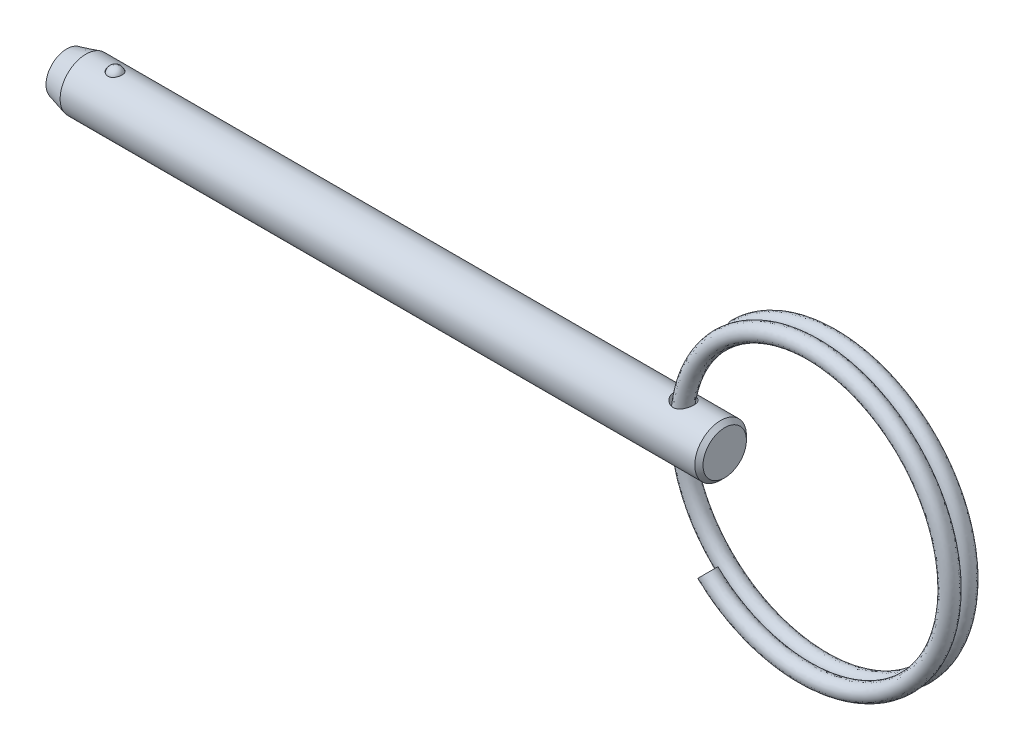
from build123d import *

# Parameters (mm, degrees)
SKETCH4_W          = 0.9525
SKETCH4_H          = 4.7625
SWEEP1_PITCH       = 1.5494
SWEEP1_HEIGHT      = 1.355725
SWEEP1_RADIUS      = 13.462
SKETCH6_R          = 0.762
SWEEP2_PITCH       = 1.5494
SWEEP2_HEIGHT      = 1.355725
SWEEP2_RADIUS      = 13.462
SWEEP2_START_ANGLE = -180
SKETCH6_2_R        = 0.762


with BuildPart() as part:
    # Sketch1 → Revolve1 (revolve)
    with BuildSketch(Plane.XY, mode=Mode.PRIVATE) as revolve1_sk:
        Polygon((30.3149, 2.00025), (29.9339, 2.38125), (-28.537510803, 2.38125), (-30.3149, 1.905), (-30.3149, 0), (30.3149, 0), align=None)
    revolve(revolve1_sk.sketch.rotate(Axis((30.3149, 0, 0), (1, 0, 0)), 180), axis=Axis((30.3149, 0, 0), (1, 0, 0)))

    # Sketch2 → Cut-Revolve1 (revolve, cut)
    with BuildSketch(Plane.XY):
        with BuildLine():
            Line((-25.164844331, 2.143125), (-26.530094331, 2.143125))
            ThreePointArc((-26.530094331, 2.143125), (-25.847469331, 2.82575), (-25.164844331, 2.143125))
        make_face()
    revolve(axis=Axis((-25.164844331, 2.143125, 0), (1, 0, 0)), mode=Mode.SUBTRACT)

    # Sketch4 → Cut-Revolve2 (revolve, cut)
    with BuildSketch(Plane.XY, mode=Mode.PRIVATE) as cut_revolve2_sk:
        with Locations((26.99385, 0)):
            Rectangle(SKETCH4_W, SKETCH4_H)
    revolve(cut_revolve2_sk.sketch.rotate(Axis((26.5176, -2.38125, 0), (0, 1, 0)), 180), axis=Axis((26.5176, -2.38125, 0), (0, 1, 0)), mode=Mode.SUBTRACT)


with BuildPart() as body_2:
    # Sketch3 → Revolve2 (revolve)
    with BuildSketch(Plane.XY):
        with BuildLine():
            Line((-25.190244331, 2.143125), (-26.504694331, 2.143125))
            ThreePointArc((-26.504694331, 2.143125), (-25.847469331, 2.80035), (-25.190244331, 2.143125))
        make_face()
    revolve(axis=Axis((-25.190244331, 2.143125, 0), (1, 0, 0)))


with BuildPart() as body_3:
    # Sweep1: sweep along a helix
    with BuildLine() as sweep1_path:
        Helix(SWEEP1_PITCH, SWEEP1_HEIGHT, SWEEP1_RADIUS, center=(39.097648906, 0, 0), direction=(0, 0, -1), lefthand=True)
    # Sketch6 → Sweep1 (sweep)
    with BuildSketch(Plane(origin=(114.003847968, 0, 0), x_dir=(0, 0, -1), z_dir=(0, 1, 0))):
        with Locations((0, 87.606199061)):
            Circle(SKETCH6_R)
    sweep(path=sweep1_path.line, is_frenet=True)

    # Sweep2: sweep along a helix
    with BuildLine() as sweep2_path:
        add(Helix(SWEEP2_PITCH, SWEEP2_HEIGHT, SWEEP2_RADIUS, center=(39.097648906, 0, 0), direction=(0, 0, 1), lefthand=True, mode=Mode.PRIVATE).rotate(Axis((39.097648906, 0, 0), (0, 0, 1)), SWEEP2_START_ANGLE))
    # Sketch6<2> → Sweep2 (sweep)
    with BuildSketch(Plane(origin=(114.003847968, 0, 0), x_dir=(0, 0, -1), z_dir=(0, 1, 0))):
        with Locations((0, 87.606199061)):
            Circle(SKETCH6_2_R)
    sweep(path=sweep2_path.line, is_frenet=True)


solid = Compound([part.part, body_2.part, body_3.part])
